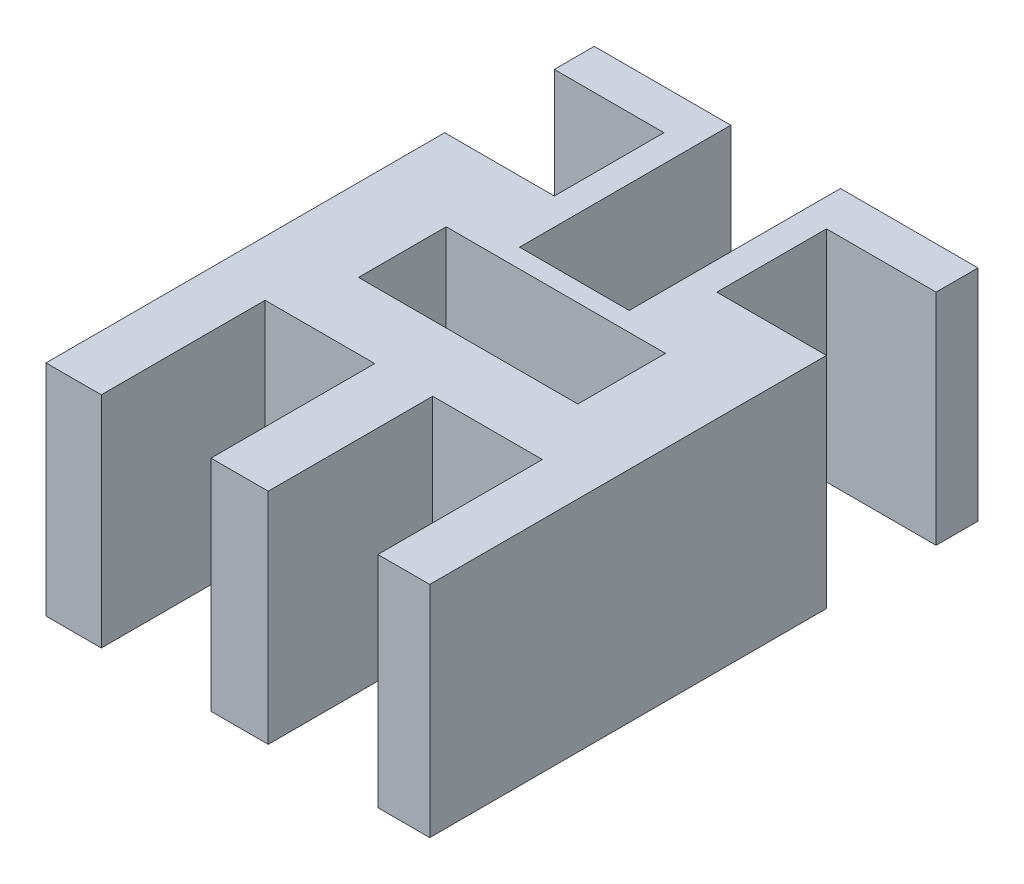
from build123d import *

# Parameters (mm, degrees)
SKETCH_1_W          = 70
SKETCH_1_H          = 100
EXTRUDE_1_DEPTH     = 40
SKETCH_3_W          = 20
SKETCH_3_H          = 20
CUT_EXTRUDE_1_DEPTH = 40
SKETCH_5_W          = 20
SKETCH_5_H          = 30
SKETCH_5_H_2        = 29.917444877
CUT_EXTRUDE_4_DEPTH = 40
SKETCH_13_W         = 40
SKETCH_13_H         = 16
CUT_EXTRUDE_5_DEPTH = 40
SKETCH_15_W         = 20
SKETCH_15_H         = 40
CUT_EXTRUDE_6_DEPTH = 40


with BuildPart() as part:
    # 草图1 → 凸台-拉伸1 (new body)
    with BuildSketch(Plane(origin=(0, 0, 0), x_dir=(1, 0, 0), z_dir=(0, 1, 0))):
        Rectangle(SKETCH_1_W, SKETCH_1_H)
    extrude(amount=EXTRUDE_1_DEPTH)

    # 草图3 → 切除-拉伸1 (cut)
    with BuildSketch(Plane.XZ):
        with Locations((-25, -32.719295767)):
            Rectangle(SKETCH_3_W, SKETCH_3_H)
        with Locations((25.007645878, -32.353993134)):
            Rectangle(SKETCH_3_W, SKETCH_3_H)
    extrude(amount=-CUT_EXTRUDE_1_DEPTH, mode=Mode.SUBTRACT)

    # 草图5 → 切除-拉伸4 (cut)
    with BuildSketch(Plane(origin=(0, 40, 0), x_dir=(1, 0, 0), z_dir=(0, 1, 0))):
        with Locations((15.536368654, -35)):
            Rectangle(SKETCH_5_W, SKETCH_5_H)
        with Locations((-14.909129338, -35.083562285)):
            Rectangle(SKETCH_5_W, SKETCH_5_H_2)
    extrude(amount=-CUT_EXTRUDE_4_DEPTH, mode=Mode.SUBTRACT)

    # 草图13 → 切除-拉伸5 (cut)
    with BuildSketch(Plane(origin=(0, 40, 0), x_dir=(1, 0, 0), z_dir=(0, 1, 0))):
        Rectangle(SKETCH_13_W, SKETCH_13_H)
    extrude(amount=-CUT_EXTRUDE_5_DEPTH, mode=Mode.SUBTRACT)

    # 草图15 → 切除-拉伸6 (cut)
    with BuildSketch(Plane(origin=(0, 40, 0), x_dir=(1, 0, 0), z_dir=(0, 1, 0))):
        with Locations((-0.091013634, 31.465991837)):
            Rectangle(SKETCH_15_W, SKETCH_15_H)
    extrude(amount=-CUT_EXTRUDE_6_DEPTH, mode=Mode.SUBTRACT)


solid = part.part
